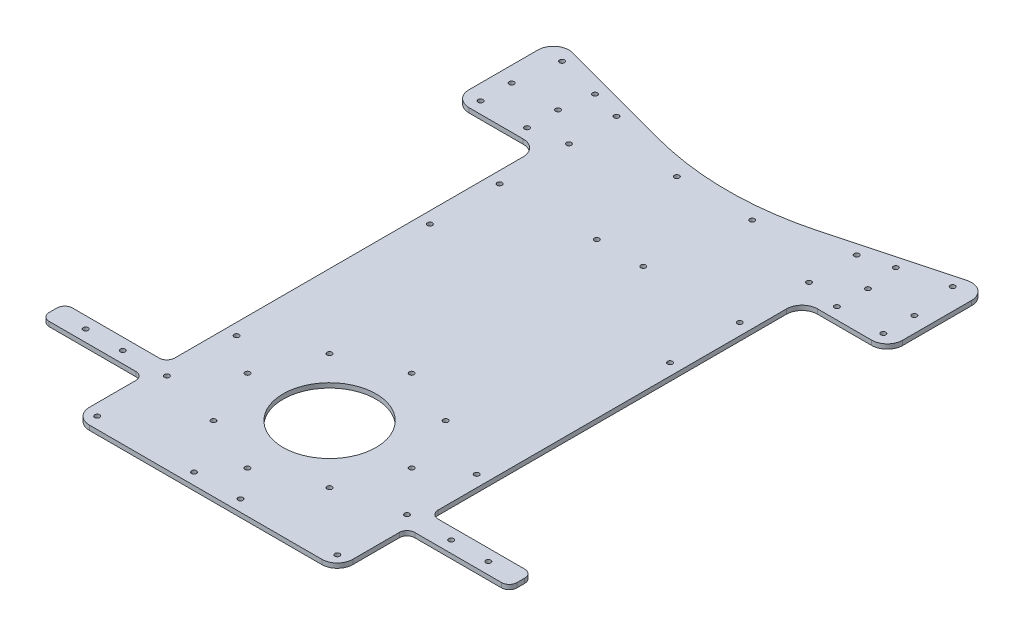
from build123d import *

# Parameters (mm, degrees)
BOSS_EXTRUDE1_DEPTH = 3
FILLET1_R           = 200
FILLET2_R           = 10
SKETCH2_R           = 30
CUT_EXTRUDE1_DEPTH  = 429.345808882
SKETCH3_W           = 66
SKETCH3_H           = 15
SKETCH3_R           = 1.6
BOSS_EXTRUDE2_DEPTH = 3
FILLET3_R           = 5
SKETCH4_R           = 1.6
CUT_EXTRUDE2_DEPTH  = 435.224748243
SKETCH5_R           = 1.6
CUT_EXTRUDE3_DEPTH  = 435.224748243
SKETCH7_R           = 1.6
CUT_EXTRUDE4_DEPTH  = 435.224748243
SKETCH8_R           = 1.6
CUT_EXTRUDE5_DEPTH  = 10


with BuildPart() as part:
    # Sketch1 → Boss-Extrude1 (new body)
    with BuildSketch(Plane(origin=(0, 0, 0), x_dir=(1, 0, 0), z_dir=(0, 1, 0))):
        Polygon((0, 0), (170, 0), (170, 300), (225, 300), (225, 367.51288694), (85, 330), (-55, 367.51288694), (-55, 300), (0, 300), align=None)
    extrude(amount=BOSS_EXTRUDE1_DEPTH)

    # Fillet1
    fillet1_edges = [part.edges().sort_by_distance(p)[0] for p in [
        (85, 1.5, -330),
    ]]
    fillet(fillet1_edges, radius=FILLET1_R)

    # Fillet2
    fillet2_edges = [part.edges().sort_by_distance(p)[0] for p in [
        (0, 1.5, -300),
        (-55, 1.5, -300),
        (-55, 1.5, -367.51288694),
        (225, 1.5, -367.51288694),
        (225, 1.5, -300),
        (170, 1.5, -300),
        (170, 1.5, 0),
        (0, 1.5, 0),
    ]]
    fillet(fillet2_edges, radius=FILLET2_R)

    # Sketch2 → Cut-Extrude1 (cut, through all)
    with BuildSketch(Plane(origin=(0, 3, 0), x_dir=(1, 0, 0), z_dir=(0, 1, 0))):
        with Locations(Location((85, 80, 0), (0, 0, 270))):
            Circle(SKETCH2_R)
    extrude(amount=-CUT_EXTRUDE1_DEPTH, mode=Mode.SUBTRACT)

    # Sketch3 → Boss-Extrude2 (add)
    # profile 1 of 2: a face of its own
    with BuildSketch(Plane(origin=(0, 3, 0), x_dir=(1, 0, 0), z_dir=(0, 1, 0))):
        with Locations((-33, 52.5)):
            Rectangle(SKETCH3_W, SKETCH3_H)
        with Locations(Location((-21, 52.5, 0), (0, 0, 270))):
            Circle(SKETCH3_R, mode=Mode.SUBTRACT)
        with Locations(Location((-45, 52.5, 0), (0, 0, 270))):
            Circle(SKETCH3_R, mode=Mode.SUBTRACT)
    # profile 2 of 2: a face of its own
    with BuildSketch(Plane(origin=(0, 3, 0), x_dir=(1, 0, 0), z_dir=(0, 1, 0))):
        with Locations((203, 52.5)):
            Rectangle(SKETCH3_W, SKETCH3_H)
        with Locations(Location((191, 52.5, 0), (0, 0, 90))):
            Circle(SKETCH3_R, mode=Mode.SUBTRACT)
        with Locations(Location((215, 52.5, 0), (0, 0, 90))):
            Circle(SKETCH3_R, mode=Mode.SUBTRACT)
    extrude(amount=-BOSS_EXTRUDE2_DEPTH)

    # Fillet3
    fillet3_edges = [part.edges().sort_by_distance(p)[0] for p in [
        (0, 1.5, -60),
        (0, 1.5, -45),
        (-66, 1.5, -45),
        (-66, 1.5, -60),
        (170, 1.5, -45),
        (170, 1.5, -60),
        (236, 1.5, -60),
        (236, 1.5, -45),
    ]]
    fillet(fillet3_edges, radius=FILLET3_R)

    # Sketch4 → Cut-Extrude2 (cut, through all)
    with BuildSketch(Plane.XZ):
        with Locations(Location((162.5, -7.5, 0), (0, 0, 270))):
            Circle(SKETCH4_R)
        with Locations(Location((162.5, -52.5, 0), (0, 0, 270))):
            Circle(SKETCH4_R)
        with Locations(Location((100, -7.5, 0), (0, 0, 270))):
            Circle(SKETCH4_R)
        with Locations(Location((70, -7.5, 0), (0, 0, 270))):
            Circle(SKETCH4_R)
        with Locations(Location((162.5, -97.5, 0), (0, 0, 270))):
            Circle(SKETCH4_R)
        with Locations(Location((162.5, -222.3, 0), (0, 0, 270))):
            Circle(SKETCH4_R)
        with Locations(Location((162.5, -267.3, 0), (0, 0, 270))):
            Circle(SKETCH4_R)
        with Locations(Location((162.5, -312, 0), (0, 0, 270))):
            Circle(SKETCH4_R)
        with Locations(Location((162.5, -342.75495241, 0), (0, 0, 270))):
            Circle(SKETCH4_R)
        with Locations(Location((109.337835254, -328.510193298, 0), (0, 0, 270))):
            Circle(SKETCH4_R)
        with Locations(Location((60.662164746, -328.510193298, 0), (0, 0, 270))):
            Circle(SKETCH4_R)
        with Locations(Location((7.5, -342.75495241, 0), (0, 0, 270))):
            Circle(SKETCH4_R)
        with Locations(Location((7.5, -312, 0), (0, 0, 270))):
            Circle(SKETCH4_R)
        with Locations(Location((7.5, -267.3, 0), (0, 0, 270))):
            Circle(SKETCH4_R)
        with Locations(Location((7.5, -222.3, 0), (0, 0, 270))):
            Circle(SKETCH4_R)
        with Locations(Location((7.5, -97.5, 0), (0, 0, 270))):
            Circle(SKETCH4_R)
        with Locations(Location((7.5, -52.5, 0), (0, 0, 270))):
            Circle(SKETCH4_R)
        with Locations(Location((7.5, -7.5, 0), (0, 0, 270))):
            Circle(SKETCH4_R)
        with Locations(Location((70, -267.5, 0), (0, 0, 270))):
            Circle(SKETCH4_R)
        with Locations(Location((100, -267.5, 0), (0, 0, 270))):
            Circle(SKETCH4_R)
    extrude(amount=-CUT_EXTRUDE2_DEPTH, mode=Mode.SUBTRACT)

    # Sketch5 → Cut-Extrude3 (cut, through all)
    with BuildSketch(Plane(origin=(0, 3, 0), x_dir=(1, 0, 0), z_dir=(0, 1, 0))):
        with Locations(Location((-40.836994935, 355.953349818, 0), (0, 0, 270))):
            Circle(SKETCH5_R)
        with Locations(Location((-11.859220146, 348.188778465, 0), (0, 0, 270))):
            Circle(SKETCH5_R)
        with Locations(Location((182.234220146, 348.289259412, 0), (0, 0, 270))):
            Circle(SKETCH5_R)
        with Locations(Location((211.211994935, 356.053830765, 0), (0, 0, 270))):
            Circle(SKETCH5_R)
    extrude(amount=-CUT_EXTRUDE3_DEPTH, mode=Mode.SUBTRACT)

    # Sketch7 → Cut-Extrude4 (cut, through all)
    with BuildSketch(Plane(origin=(0, 3, 0), x_dir=(1, 0, 0), z_dir=(0, 1, 0))):
        with Locations(Location((-45, 327.5, 0), (0, 0, 270))):
            Circle(SKETCH7_R)
        with Locations(Location((-45, 307.5, 0), (0, 0, 270))):
            Circle(SKETCH7_R)
        with Locations(Location((-15, 327.5, 0), (0, 0, 270))):
            Circle(SKETCH7_R)
        with Locations(Location((-15, 307.5, 0), (0, 0, 270))):
            Circle(SKETCH7_R)
        with Locations(Location((185, 327.5, 0), (0, 0, 90))):
            Circle(SKETCH7_R)
        with Locations(Location((185, 307.5, 0), (0, 0, 90))):
            Circle(SKETCH7_R)
        with Locations(Location((215, 307.5, 0), (0, 0, 90))):
            Circle(SKETCH7_R)
        with Locations(Location((215, 327.5, 0), (0, 0, 90))):
            Circle(SKETCH7_R)
    extrude(amount=-CUT_EXTRUDE4_DEPTH, mode=Mode.SUBTRACT)

    # Sketch8 → Cut-Extrude5 (cut)
    with BuildSketch(Plane(origin=(0, 3, 0), x_dir=(1, 0, 0), z_dir=(0, 1, 0))):
        with Locations(Location((85, 133, 0), (0, 0, 270))):
            Circle(SKETCH8_R)
        with Locations(Location((122.476659403, 117.476659403, 0), (0, 0, 270))):
            Circle(SKETCH8_R)
        with Locations(Location((138, 80, 0), (0, 0, 270))):
            Circle(SKETCH8_R)
        with Locations(Location((122.476659403, 42.523340597, 0), (0, 0, 270))):
            Circle(SKETCH8_R)
        with Locations(Location((85, 27, 0), (0, 0, 270))):
            Circle(SKETCH8_R)
        with Locations(Location((47.523340597, 42.523340597, 0), (0, 0, 270))):
            Circle(SKETCH8_R)
        with Locations(Location((32, 80, 0), (0, 0, 270))):
            Circle(SKETCH8_R)
        with Locations(Location((47.523340597, 117.476659403, 0), (0, 0, 270))):
            Circle(SKETCH8_R)
    extrude(amount=-CUT_EXTRUDE5_DEPTH, mode=Mode.SUBTRACT)


solid = part.part
